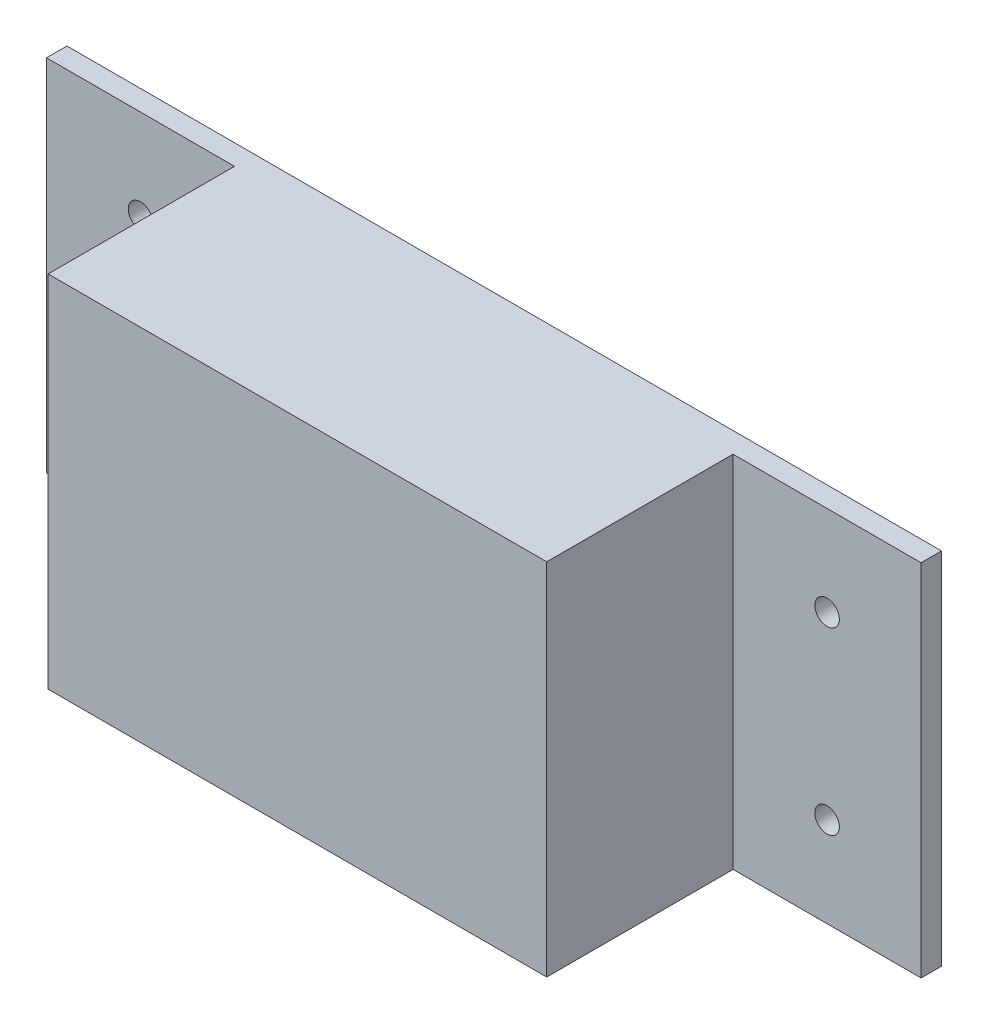
from build123d import *

# Parameters (mm, degrees)
SKETCH1_W           = 61
SKETCH1_H           = 44
SKETCH1_W_2         = 55
SKETCH1_H_2         = 38
BOSS_EXTRUDE1_DEPTH = 23
SKETCH2_W           = 61
SKETCH2_H           = 44
BOSS_EXTRUDE2_DEPTH = 2.3
SKETCH3_W           = 2.5
SKETCH3_H           = 44
BOSS_EXTRUDE3_DEPTH = 23
SKETCH5_W           = 2.5
SKETCH5_H           = 44
BOSS_EXTRUDE4_DEPTH = 23
SKETCH6_R           = 1.5
CUT_EXTRUDE1_DEPTH  = 23


with BuildPart() as part:
    # Sketch1 → Boss-Extrude1 (new body)
    with BuildSketch(Plane.XY):
        Rectangle(SKETCH1_W, SKETCH1_H)
        Rectangle(SKETCH1_W_2, SKETCH1_H_2, mode=Mode.SUBTRACT)
    extrude(amount=BOSS_EXTRUDE1_DEPTH)

    # Sketch2 → Boss-Extrude2 (add)
    with BuildSketch(Plane.XY.offset(23)):
        Rectangle(SKETCH2_W, SKETCH2_H)
    extrude(amount=BOSS_EXTRUDE2_DEPTH)

    # Sketch3 → Boss-Extrude3 (add)
    with BuildSketch(Plane.ZY.offset(30.5)):
        with Locations((1.25, 0)):
            Rectangle(SKETCH3_W, SKETCH3_H)
    extrude(amount=BOSS_EXTRUDE3_DEPTH)

    # Sketch5 → Boss-Extrude4 (add)
    with BuildSketch(Plane(origin=(30.5, 0, 0), x_dir=(0, 0, -1), z_dir=(1, 0, 0))):
        with Locations((-1.25, 0)):
            Rectangle(SKETCH5_W, SKETCH5_H)
    extrude(amount=BOSS_EXTRUDE4_DEPTH)

    # Sketch6 → Cut-Extrude1 (cut)
    with BuildSketch(Plane.XY.offset(2.5)):
        with Locations((42, 11)):
            Circle(SKETCH6_R)
        with Locations(Location((42, -11, 0), (0, 0, 180))):
            Circle(SKETCH6_R)
        with Locations((-42, -11)):
            Circle(SKETCH6_R)
        with Locations(Location((-42, 11, 0), (0, 0, 180))):
            Circle(SKETCH6_R)
    extrude(amount=-CUT_EXTRUDE1_DEPTH, mode=Mode.SUBTRACT)


solid = part.part
